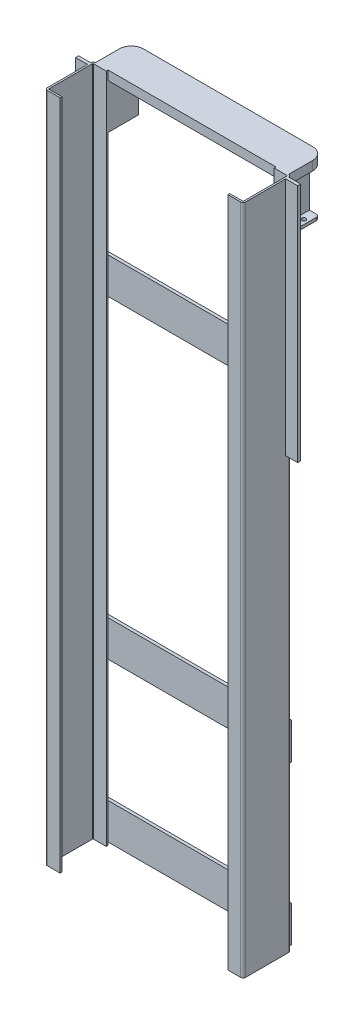
from build123d import *

# Parameters (mm, degrees)
EXTRUDE_THIN1_DEPTH  = 1400
SKETCH2_W            = 50
SKETCH2_H            = 12.5
BOSS_EXTRUDE1_DEPTH  = 1000
BOSS_EXTRUDE2_DEPTH  = 38
SKETCH5_W            = 806
SKETCH5_H            = 150
BOSS_EXTRUDE3_DEPTH  = 12.5
LPATTERN1_COUNT      = 2
LPATTERN1_PITCH      = 660
LPATTERN2_COUNT      = 2
LPATTERN2_PITCH      = 1970
SKETCH6_W            = 12.5
SKETCH6_H            = 127
BOSS_EXTRUDE4_DEPTH  = 175
SKETCH7_W            = 53
SKETCH7_H            = 127
SKETCH7_R            = 8.75
BOSS_EXTRUDE5_DEPTH  = 12.5
FILLET1_R            = 12.5
FILLET1_OF_MIRROR2_R = 12.5


with BuildPart() as part:
    # Sketch1 → Extrude-Thin1 (new, symmetric)
    with BuildSketch(Plane(origin=(0, 0, 0), x_dir=(1, 0, 0), z_dir=(0, 1, 0))):
        with BuildLine():
            Line((350, 100), (403, 100))
            ThreePointArc((403, 100), (410.071067812, 97.071067812), (413, 90))
            Line((413, 90), (413, -90))
            ThreePointArc((413, -90), (410.071067812, -97.071067812), (403, -100))
            Line((403, -100), (350, -100))
            Line((350, -100), (350, -92.5))
            Line((350, -92.5), (403, -92.5))
            ThreePointArc((403, -92.5), (404.767766953, -91.767766953), (405.5, -90))
            Line((405.5, -90), (405.5, 90))
            ThreePointArc((405.5, 90), (404.767766953, 91.767766953), (403, 92.5))
            Line((403, 92.5), (350, 92.5))
            Line((350, 92.5), (350, 100))
        make_face()
    extrude(amount=EXTRUDE_THIN1_DEPTH, both=True)

    # Sketch2 → Boss-Extrude1 (add)
    with BuildSketch(Plane(origin=(0, 1400, 0), x_dir=(1, 0, 0), z_dir=(0, 1, 0))):
        with Locations((438, 83.75)):
            Rectangle(SKETCH2_W, SKETCH2_H)
    extrude(amount=-BOSS_EXTRUDE1_DEPTH)


with BuildPart() as body_2:
    # Mirror1: mirrored copy
    add(part.part.mirror(Plane(origin=(0, 0, 0), x_dir=(0, 0, 1), z_dir=(1, 0, 0))))


with BuildPart() as part_1:
    add(part.part)

    add(body_2.part)  # Boss-Extrude2 merges body 2
    # Sketch4 → Boss-Extrude2 (add)
    with BuildSketch(Plane(origin=(0, 1400, 0), x_dir=(1, 0, 0), z_dir=(0, 1, 0))):
        with BuildLine():
            Line((-403, 100), (403, 100))
            Line((403, 100), (403, 200))
            ThreePointArc((403, 200), (388.355339059, 235.355339059), (353, 250))
            Line((353, 250), (-353, 250))
            ThreePointArc((-353, 250), (-388.355339059, 235.355339059), (-403, 200))
            Line((-403, 200), (-403, 100))
        make_face()
    extrude(amount=-BOSS_EXTRUDE2_DEPTH)

    # Sketch5 → Boss-Extrude3 (add)
    with BuildSketch(Plane(origin=(0, 0, -100), x_dir=(-1, 0, 0), z_dir=(0, 0, -1))):
        with Locations((0, -1312.5)):
            Rectangle(SKETCH5_W, SKETCH5_H)
    boss_extrude3 = extrude(amount=BOSS_EXTRUDE3_DEPTH)

    # LPattern1: Boss-Extrude3 ×2
    with Locations(*[(0, i * LPATTERN1_PITCH, 0) for i in range(1, LPATTERN1_COUNT)]):
        add(boss_extrude3)

    # LPattern2: Boss-Extrude3 ×2
    with Locations(*[(0, i * LPATTERN2_PITCH, 0) for i in range(1, LPATTERN2_COUNT)]):
        add(boss_extrude3)

    # Sketch6 → Boss-Extrude4 (add)
    with BuildSketch(Plane.XZ.offset(-1362)):
        with Locations((356.25, -163.5)):
            Rectangle(SKETCH6_W, SKETCH6_H)
    boss_extrude4 = extrude(amount=BOSS_EXTRUDE4_DEPTH)

    # Sketch7 → Boss-Extrude5 (add)
    with BuildSketch(Plane.XZ.offset(-1187)):
        with Locations((376.5, -163.5)):
            Rectangle(SKETCH7_W, SKETCH7_H)
        with Locations(Location((384, -182, 0), (0, 0, 270))):
            Circle(SKETCH7_R, mode=Mode.SUBTRACT)
    boss_extrude5 = extrude(amount=BOSS_EXTRUDE5_DEPTH)

    # Fillet1
    fillet1_edges = [part_1.edges().sort_by_distance(p)[0] for p in [
        (403, 1180.75, -227),
    ]]
    fillet(fillet1_edges, radius=FILLET1_R)

    # Mirror2: Boss-Extrude4, Boss-Extrude5 across plane
    add(boss_extrude4.mirror(Plane(origin=(0, 0, 0), x_dir=(0, 0, 1), z_dir=(1, 0, 0))))
    add(boss_extrude5.mirror(Plane(origin=(0, 0, 0), x_dir=(0, 0, 1), z_dir=(1, 0, 0))))

    # Fillet1 of Mirror2
    fillet1_of_mirror2_edges = [part_1.edges().sort_by_distance(p)[0] for p in [
        (-403, 1180.75, -227),
    ]]
    fillet(fillet1_of_mirror2_edges, radius=FILLET1_OF_MIRROR2_R)


solid = part_1.part
